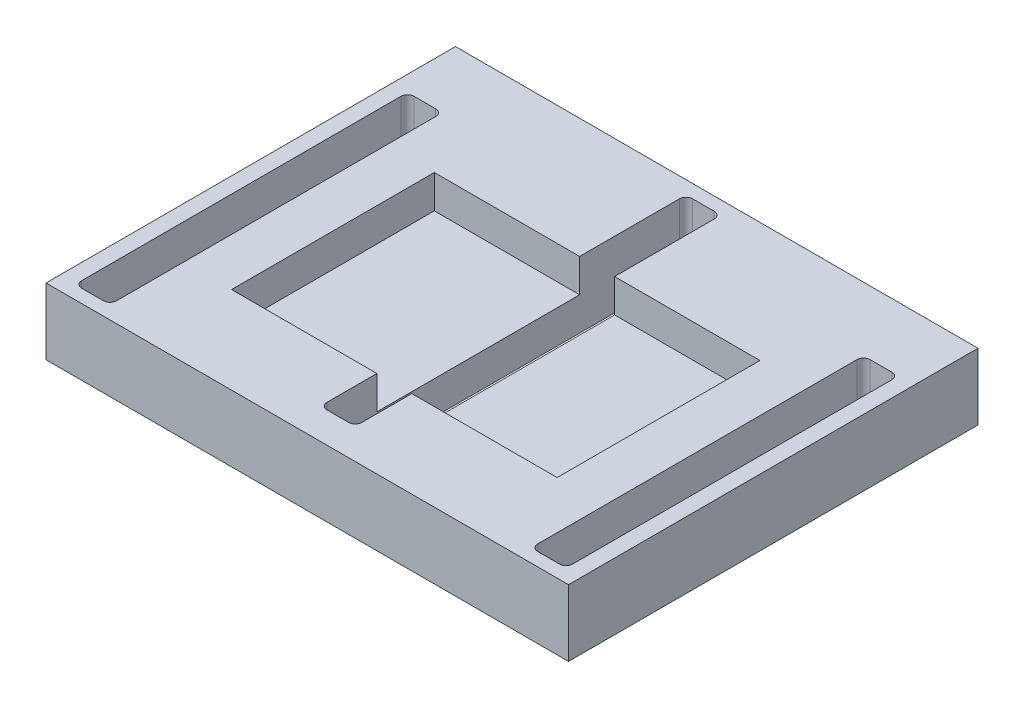
from build123d import *

# Parameters (mm, degrees)
BOSS_EXTRUDE1_DEPTH  = 10
FILLET1_R            = 1
SKETCH2_W            = 21.86553483
SKETCH2_H            = 30.5
CUT_EXTRUDE1_DEPTH   = 5
FILLET1_OF_MIRROR1_R = 1


with BuildPart() as part:
    # Sketch1 → Boss-Extrude1 (new body)
    with BuildSketch(Plane(origin=(0, 0, 0), x_dir=(1, 0, 0), z_dir=(0, 1, 0))):
        Polygon((-5, 57.097150921), (34.3, 57.097150921), (34.3, 55.097150921), (31.675, 55.097150921), (31.675, 52.597150921), (31.675, 2.599340873), (31.675, 0.099340873), (34.3, 0.099340873), (34.3, -4.5), (-5, -4.5), align=None)
        Polygon((-2.625, 45), (-2.625, 0), (-2.625, -2.5), (0, -2.5), (2.625, -2.5), (2.625, 0), (2.625, 45), (2.625, 47.5), (0, 47.5), (-2.625, 47.5), align=None, mode=Mode.SUBTRACT)
    boss_extrude1 = extrude(amount=BOSS_EXTRUDE1_DEPTH)

    # Fillet1
    fillet1_edges = [part.edges().sort_by_distance(p)[0] for p in [
        (31.675, 5, -55.097150921),
        (31.675, 5, -0.099340873),
        (-2.625, 5, -47.5),
        (-2.625, 5, 2.5),
        (2.625, 5, 2.5),
        (2.625, 5, -47.5),
    ]]
    fillet(fillet1_edges, radius=FILLET1_R)

    # Sketch2 → Cut-Extrude1 (cut)
    with BuildSketch(Plane(origin=(0, 10, 0), x_dir=(1, 0, 0), z_dir=(0, 1, 0))):
        with Locations((20.742232585, 23.8519351)):
            Rectangle(SKETCH2_W, SKETCH2_H)
    cut_extrude1 = extrude(amount=-CUT_EXTRUDE1_DEPTH, mode=Mode.SUBTRACT)

    # Mirror1: Boss-Extrude1, Cut-Extrude1 across plane
    add(boss_extrude1.mirror(Plane(origin=(34.3, 10, -0.099340873), x_dir=(0, 0, 1), z_dir=(-1, 0, 0))))
    add(cut_extrude1.mirror(Plane(origin=(34.3, 10, -0.099340873), x_dir=(0, 0, 1), z_dir=(-1, 0, 0))), mode=Mode.SUBTRACT)

    # Fillet1 of Mirror1
    fillet1_of_mirror1_edges = [part.edges().sort_by_distance(p)[0] for p in [
        (36.925, 5, -55.097150921),
        (36.925, 5, -0.099340873),
        (71.225, 5, -47.5),
        (71.225, 5, 2.5),
        (65.975, 5, 2.5),
        (65.975, 5, -47.5),
    ]]
    fillet(fillet1_of_mirror1_edges, radius=FILLET1_OF_MIRROR1_R)


solid = part.part
